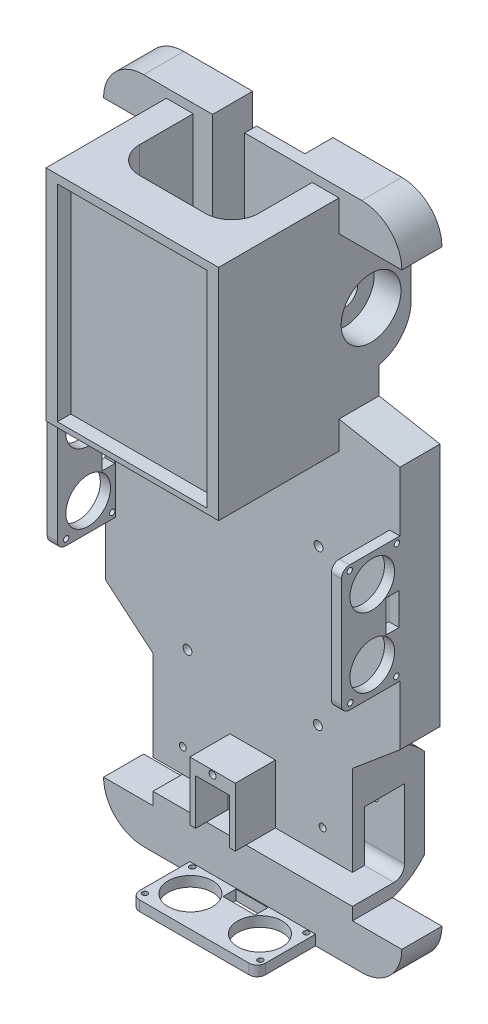
from build123d import *

# Parameters (mm, degrees)
CROQUIS1_W                  = 30
CROQUIS1_H                  = 30
SALIENTE_EXTRUIR1_DEPTH     = 15
CROQUIS6_R                  = 11.175
CORTAR_EXTRUIR1_DEPTH       = 10
CROQUIS11_W                 = 17.25
CROQUIS11_H                 = 40
SALIENTE_EXTRUIR3_DEPTH     = 12
CORTAR_EXTRUIR2_DEPTH       = 220.794464504
CORTAR_EXTRUIR2_DEPTH_BACK  = 220.794464504
CROQUIS9_R                  = 5
CROQUIS14_W                 = 64.5
CROQUIS14_H                 = 82
SALIENTE_EXTRUIR4_DEPTH     = 40
CORTAR_EXTRUIR3_START       = -10
CROQUIS10_R                 = 11.175
CORTAR_EXTRUIR3_DEPTH       = 10
CORTAR_EXTRUIR5_DEPTH       = 230.716361252
CORTAR_EXTRUIR5_DEPTH_BACK  = 10
CROQUIS13_R                 = 11.175
CORTAR_EXTRUIR6_DEPTH       = 183.220714139
CROQUIS16_W                 = 64.5
CROQUIS16_H                 = 82
CROQUIS16_W_2               = 56
CROQUIS16_H_2               = 77
SALIENTE_EXTRUIR5_DEPTH     = 5
CROQUIS17_W                 = 30
CROQUIS17_H                 = 30
CORTAR_EXTRUIR7_DEPTH       = 218.102899858
CROQUIS19_W                 = 18
CROQUIS19_H                 = 4.5
SALIENTE_EXTRUIR6_DEPTH     = 60
CROQUIS22_W                 = 12
CROQUIS22_H                 = 15
CORTAR_EXTRUIR8_DEPTH       = 2
CROQUIS23_W                 = 3.8
CROQUIS23_H                 = 47
SALIENTE_EXTRUIR8_DEPTH     = 19.8
CROQUIS24_R                 = 8.35
CROQUIS24_R_2               = 1
CROQUIS24_W                 = 4.8
CROQUIS24_H                 = 12
CORTAR_EXTRUIR10_DEPTH      = 241.553879883
CROQUIS25_W                 = 3.8
CROQUIS25_H                 = 47
SALIENTE_EXTRUIR9_DEPTH     = 2
REDONDEO2_R                 = 3
CROQUIS26_W                 = 47
CROQUIS26_H                 = 3.8
SALIENTE_EXTRUIR10_DEPTH    = 21.8
REDONDEO3_R                 = 3
CROQUIS28_R                 = 8.35
CROQUIS28_R_2               = 1
CROQUIS28_W                 = 12
CROQUIS28_H                 = 4.8
CORTAR_EXTRUIR11_DEPTH      = 21.8
CORTAR_EXTRUIR12_DEPTH      = 231.964513782
CORTAR_EXTRUIR12_DEPTH_BACK = 231.964513782
CORTAR_EXTRUIR13_DEPTH      = 218.102899858
CORTAR_EXTRUIR13_DEPTH_BACK = 218.102899858
CROQUIS29_R                 = 1.65
CORTAR_EXTRUIR14_DEPTH      = 221.700405815
CORTAR_EXTRUIR14_DEPTH_BACK = 8
CROQUIS32_R                 = 5.15
CROQUIS34_W                 = 22.273731586
CROQUIS34_H                 = 49.346142378
SALIENTE_EXTRUIR11_DEPTH    = 12
CORTAR_EXTRUIR17_DEPTH      = 233.924926242
CORTAR_EXTRUIR17_DEPTH_BACK = 233.924926242
CORTAR_EXTRUIR18_DEPTH      = 233.924926242
CORTAR_EXTRUIR18_DEPTH_BACK = 233.924926242
CORTAR_EXTRUIR19_DEPTH      = 225.26027095
CORTAR_EXTRUIR19_DEPTH_BACK = 225.26027095
CROQUIS38_R                 = 1.3
CORTAR_EXTRUIR20_START      = -8.5
CROQUIS39_W                 = 74.547463172
CROQUIS39_H                 = 11
CORTAR_EXTRUIR20_DEPTH      = 8.5
CROQUIS40_W                 = 17
CROQUIS40_H                 = 22
SALIENTE_EXTRUIR12_DEPTH    = 15
CROQUIS41_R                 = 1.3
CORTAR_EXTRUIR25_DEPTH      = 15
CROQUIS42_W                 = 12.6
CROQUIS42_H                 = 7
CORTAR_EXTRUIR26_DEPTH      = 7.1
CROQUIS43_W                 = 12.6
CROQUIS43_H                 = 10
CORTAR_EXTRUIR27_DEPTH      = 12.1


with BuildPart() as part:
    # Croquis1 → Saliente-Extruir1 (new body)
    with BuildSketch(Plane.XY):
        with BuildLine():
            Line((-55.75, 30), (-32.25, 30))
            Line((-32.25, 30), (-32.25, -30))
            Line((-32.25, -30), (-55, -34.220247666))
            Line((-55, -34.220247666), (-55, -125.720247666))
            Line((-55, -125.720247666), (-37.273731586, -140.594352954))
            Line((-37.273731586, -140.594352954), (-37.273731586, -189.940495332))
            Line((-37.273731586, -189.940495332), (-55.75, -189.940495332))
            ThreePointArc((-55.75, -189.940495332), (-51.356645257, -200.54705351), (-40.750123148, -204.940495332))
            Line((-40.750123148, -204.940495332), (0, -204.940495332))
            Line((0, -204.940495332), (40.75, -204.940495332))
            ThreePointArc((40.75, -204.940495332), (51.356601718, -200.547097049), (55.75, -189.940495332))
            Line((55.75, -189.940495332), (37.273731586, -189.940495332))
            Line((37.273731586, -189.940495332), (37.273731586, -140.594352954))
            Line((37.273731586, -140.594352954), (55, -125.720247666))
            Line((55, -125.720247666), (55, -34.220247666))
            Line((55, -34.220247666), (32.25, -30))
            Line((32.25, -30), (32.25, 30))
            Line((32.25, 30), (55.75, 30))
            ThreePointArc((55.75, 30), (51.356601718, 40.606601718), (40.75, 45))
            Line((40.75, 45), (0, 45))
            Line((0, 45), (-40.750123148, 45))
            ThreePointArc((-40.750123148, 45), (-51.356645257, 40.606558178), (-55.75, 30))
        make_face()
        Rectangle(CROQUIS1_W, CROQUIS1_H, mode=Mode.SUBTRACT)
    extrude(amount=SALIENTE_EXTRUIR1_DEPTH)

    # Croquis6 → Cortar-Extruir1 (cut)
    with BuildSketch(Plane.ZY.offset(32.25)):
        with Locations((3, 0)):
            Circle(CROQUIS6_R)
    extrude(amount=-CORTAR_EXTRUIR1_DEPTH, mode=Mode.SUBTRACT)

    # Croquis11 → Saliente-Extruir3 (add)
    with BuildSketch(Plane(origin=(0, 0, 0), x_dir=(-1, 0, 0), z_dir=(0, 0, -1))):
        with Locations((23.625, 0)):
            Rectangle(CROQUIS11_W, CROQUIS11_H)
        with Locations((-23.625, 0)):
            Rectangle(CROQUIS11_W, CROQUIS11_H)
    extrude(amount=SALIENTE_EXTRUIR3_DEPTH)

    # Croquis9 → Cortar-Extruir2 (cut, two sides: drawn at the far end of the back side and taken through both)
    with BuildSketch(Plane.ZY.offset(22.25).offset(-CORTAR_EXTRUIR2_DEPTH_BACK)):
        with Locations(Location((3, 0, 0), (0, 0, 233.130102354))):
            Circle(CROQUIS9_R)
    extrude(amount=CORTAR_EXTRUIR2_DEPTH + CORTAR_EXTRUIR2_DEPTH_BACK, mode=Mode.SUBTRACT)

    # Croquis14 → Saliente-Extruir4 (add)
    with BuildSketch(Plane.XY.offset(15)):
        with Locations((0, 0.593167368)):
            Rectangle(CROQUIS14_W, CROQUIS14_H)
    extrude(amount=SALIENTE_EXTRUIR4_DEPTH)

    # Croquis10 → Cortar-Extruir3 (cut)
    with BuildSketch(Plane(origin=(32.25, 0, 0), x_dir=(0, 0, -1), z_dir=(1, 0, 0)).offset(CORTAR_EXTRUIR3_START)):
        with Locations((-3, 0)):
            Circle(CROQUIS10_R)
    extrude(amount=CORTAR_EXTRUIR3_DEPTH, mode=Mode.SUBTRACT)

    # Croquis13 → Cortar-Extruir5 (cut, two sides: drawn at the far end of the back side and taken through both)
    with BuildSketch(Plane.ZY.offset(32.25).offset(-CORTAR_EXTRUIR5_DEPTH_BACK)):
        with Locations((3, 0)):
            Circle(CROQUIS13_R)
    extrude(amount=CORTAR_EXTRUIR5_DEPTH + CORTAR_EXTRUIR5_DEPTH_BACK, mode=Mode.SUBTRACT)

    # Croquis15 → Cortar-Extruir6 (cut, through all)
    with BuildSketch(Plane.XZ.offset(40.406832632)):
        with BuildLine():
            Line((-22.25, 15), (-22.25, 35))
            ThreePointArc((-22.25, 35), (-19.321067812, 42.071067812), (-12.25, 45))
            Line((-12.25, 45), (12.25, 45))
            ThreePointArc((12.25, 45), (19.321067812, 42.071067812), (22.25, 35))
            Line((22.25, 35), (22.25, 15))
            Line((22.25, 15), (-22.25, 15))
        make_face()
    extrude(amount=-CORTAR_EXTRUIR6_DEPTH, mode=Mode.SUBTRACT)

    # Croquis16 → Saliente-Extruir5 (add)
    with BuildSketch(Plane.XY.offset(55)):
        with Locations((0, 0.593167368)):
            Rectangle(CROQUIS16_W, CROQUIS16_H)
        Rectangle(CROQUIS16_W_2, CROQUIS16_H_2, mode=Mode.SUBTRACT)
    extrude(amount=SALIENTE_EXTRUIR5_DEPTH)

    # Croquis17 → Cortar-Extruir7 (cut, through all)
    with BuildSketch(Plane.XY.offset(15)):
        with Locations((0, 30)):
            Rectangle(CROQUIS17_W, CROQUIS17_H)
    extrude(amount=-CORTAR_EXTRUIR7_DEPTH, mode=Mode.SUBTRACT)

    # Croquis19 → Saliente-Extruir6 (add)
    with BuildSketch(Plane(origin=(0, -15, 0), x_dir=(1, 0, 0), z_dir=(0, 1, 0))):
        with Locations((6, -12.75)):
            Rectangle(CROQUIS19_W, CROQUIS19_H)
    extrude(amount=SALIENTE_EXTRUIR6_DEPTH)

    # Croquis22 → Cortar-Extruir8 (cut)
    with BuildSketch(Plane(origin=(0, -15, 0), x_dir=(1, 0, 0), z_dir=(0, 1, 0))):
        with Locations((-9, -7.5)):
            Rectangle(CROQUIS22_W, CROQUIS22_H)
    extrude(amount=-CORTAR_EXTRUIR8_DEPTH, mode=Mode.SUBTRACT)

    # Croquis23 → Saliente-Extruir8 (add)
    with BuildSketch(Plane.XY.offset(15)):
        with Locations((53.1, -79.970247666)):
            Rectangle(CROQUIS23_W, CROQUIS23_H)
        with Locations((-53.1, -79.970247666)):
            Rectangle(CROQUIS23_W, CROQUIS23_H)
    extrude(amount=SALIENTE_EXTRUIR8_DEPTH)

    # Croquis24 → Cortar-Extruir10 (cut, through all)
    with BuildSketch(Plane(origin=(55, 0, 0), x_dir=(0, 0, -1), z_dir=(1, 0, 0))):
        with Locations((-25.3, -66.970247666)):
            Circle(CROQUIS24_R)
        with Locations((-25.3, -92.970247666)):
            Circle(CROQUIS24_R)
        with Locations((-16.3, -101.270247666)):
            Circle(CROQUIS24_R_2)
        with Locations((-33.7, -58.370247666)):
            Circle(CROQUIS24_R_2)
        with Locations((-16.1, -58.370247666)):
            Circle(CROQUIS24_R_2)
        with Locations((-33.5, -101.270247666)):
            Circle(CROQUIS24_R_2)
        with Locations((-17.7, -79.970247666)):
            Rectangle(CROQUIS24_W, CROQUIS24_H)
    extrude(amount=-CORTAR_EXTRUIR10_DEPTH, mode=Mode.SUBTRACT)

    # Croquis25 → Saliente-Extruir9 (add)
    with BuildSketch(Plane.XY.offset(34.8)):
        with Locations((-53.1, -79.970247666)):
            Rectangle(CROQUIS25_W, CROQUIS25_H)
        with Locations((53.1, -79.970247666)):
            Rectangle(CROQUIS25_W, CROQUIS25_H)
    extrude(amount=SALIENTE_EXTRUIR9_DEPTH)

    # Redondeo2
    redondeo2_edges = [part.edges().sort_by_distance(p)[0] for p in [
        (-53.1, -103.470247666, 36.8),
        (-53.1, -56.470247666, 36.8),
        (53.1, -103.470247666, 36.8),
        (53.1, -56.470247666, 36.8),
    ]]
    fillet(redondeo2_edges, radius=REDONDEO2_R)

    # Croquis26 → Saliente-Extruir10 (add)
    with BuildSketch(Plane.XY.offset(15)):
        with Locations((-6.1574e-05, -203.040495332)):
            Rectangle(CROQUIS26_W, CROQUIS26_H)
    extrude(amount=SALIENTE_EXTRUIR10_DEPTH)

    # Redondeo3
    redondeo3_edges = [part.edges().sort_by_distance(p)[0] for p in [
        (-23.500061574, -203.040495332, 36.8),
        (23.499938426, -203.040495332, 36.8),
    ]]
    fillet(redondeo3_edges, radius=REDONDEO3_R)

    # Croquis28 → Cortar-Extruir11 (cut)
    with BuildSketch(Plane.XZ.offset(204.940495332)):
        with Locations(Location((-13, 25.3, 0), (0, 0, 270))):
            Circle(CROQUIS28_R)
        with Locations(Location((13, 25.3, 0), (0, 0, 270))):
            Circle(CROQUIS28_R)
        with Locations(Location((-21.300061574, 16.3, 0), (0, 0, 270))):
            Circle(CROQUIS28_R_2)
        with Locations(Location((21.599938426, 33.7, 0), (0, 0, 270))):
            Circle(CROQUIS28_R_2)
        with Locations(Location((21.300061574, 16.3, 0), (0, 0, 270))):
            Circle(CROQUIS28_R_2)
        with Locations(Location((-21.599938426, 33.7, 0), (0, 0, 270))):
            Circle(CROQUIS28_R_2)
        with Locations((0, 17.7)):
            Rectangle(CROQUIS28_W, CROQUIS28_H)
    extrude(amount=-CORTAR_EXTRUIR11_DEPTH, mode=Mode.SUBTRACT)

    # Croquis12 → Cortar-Extruir12 (cut, two sides: drawn at the far end of the back side and taken through both)
    with BuildSketch(Plane(origin=(32.25, 0, 0), x_dir=(0, 0, -1), z_dir=(1, 0, 0)).offset(-CORTAR_EXTRUIR12_DEPTH_BACK)):
        with BuildLine():
            Line((0, 20), (12, 20))
            Line((12, 20), (12, 5))
            ThreePointArc((12, 5), (8.630857945, 14.604686356), (0, 20))
        make_face()
        with BuildLine():
            Line((12, -20), (12, -5))
            ThreePointArc((12, -5), (8.630857945, -14.604686356), (0, -20))
            Line((0, -20), (12, -20))
        make_face()
    extrude(amount=CORTAR_EXTRUIR12_DEPTH + CORTAR_EXTRUIR12_DEPTH_BACK, mode=Mode.SUBTRACT)

    # Croquis29 → Cortar-Extruir13 (cut, two sides: drawn at the far end of the back side and taken through both)
    with BuildSketch(Plane.XY.offset(15).offset(-CORTAR_EXTRUIR13_DEPTH_BACK)):
        with Locations(Location((-24.373731586, -132.994352954, 0), (0, 0, 180))):
            Circle(CROQUIS29_R)
        with Locations(Location((24.626268414, -74.994352954, 0), (0, 0, 180))):
            Circle(CROQUIS29_R)
        with Locations(Location((-24.626268414, -74.994352954, 0), (0, 0, 180))):
            Circle(CROQUIS29_R)
        with Locations(Location((24.373731586, -132.994352954, 0), (0, 0, 180))):
            Circle(CROQUIS29_R)
    extrude(amount=CORTAR_EXTRUIR13_DEPTH + CORTAR_EXTRUIR13_DEPTH_BACK, mode=Mode.SUBTRACT)

    # Croquis32 → Cortar-Extruir14 (cut, two sides: drawn at the far end of the back side and taken through both)
    with BuildSketch(Plane(origin=(0, 0, 0), x_dir=(-1, 0, 0), z_dir=(0, 0, -1)).offset(-CORTAR_EXTRUIR14_DEPTH_BACK)):
        with Locations(Location((-24.626268414, -74.994352954, 0), (0, 0, 180))):
            Circle(CROQUIS32_R)
        with Locations(Location((-24.373731586, -132.994352954, 0), (0, 0, 180))):
            Circle(CROQUIS32_R)
        with Locations(Location((24.373731586, -132.994352954, 0), (0, 0, 180))):
            Circle(CROQUIS32_R)
        with Locations(Location((24.626268414, -74.994352954, 0), (0, 0, 180))):
            Circle(CROQUIS32_R)
    extrude(amount=CORTAR_EXTRUIR14_DEPTH + CORTAR_EXTRUIR14_DEPTH_BACK, mode=Mode.SUBTRACT)

    # Croquis34 → Saliente-Extruir11 (add)
    with BuildSketch(Plane(origin=(0, 0, 0), x_dir=(-1, 0, 0), z_dir=(0, 0, -1))):
        with Locations((-26.136865793, -165.267424143)):
            Rectangle(CROQUIS34_W, CROQUIS34_H)
        with Locations((26.136865793, -165.267424143)):
            Rectangle(CROQUIS34_W, CROQUIS34_H)
    extrude(amount=SALIENTE_EXTRUIR11_DEPTH)

    # Croquis35 → Cortar-Extruir17 (cut, two sides: drawn at the far end of the back side and taken through both)
    with BuildSketch(Plane(origin=(37.273731586, 0, 0), x_dir=(0, 0, -1), z_dir=(1, 0, 0)).offset(-CORTAR_EXTRUIR17_DEPTH_BACK)):
        with BuildLine():
            Line((0, -140.594352954), (12, -140.594352954))
            Line((12, -140.594352954), (12, -148.594352954))
            ThreePointArc((12, -148.594352954), (6.568730644, -143.741256988), (0, -140.594352954))
        make_face()
        with BuildLine():
            Line((0, -189.940495332), (12, -189.940495332))
            Line((12, -189.940495332), (12, -181.940495332))
            ThreePointArc((12, -181.940495332), (6.568730644, -186.793591298), (0, -189.940495332))
        make_face()
    extrude(amount=CORTAR_EXTRUIR17_DEPTH + CORTAR_EXTRUIR17_DEPTH_BACK, mode=Mode.SUBTRACT)

    # Croquis37 → Cortar-Extruir18 (cut, two sides: drawn at the far end of the back side and taken through both)
    with BuildSketch(Plane.ZY.offset(37.273731586).offset(-CORTAR_EXTRUIR18_DEPTH_BACK)):
        with BuildLine():
            Line((-4.5, -155.267424143), (10.5, -155.267424143))
            Line((10.5, -155.267424143), (10.5, -181.267424143))
            ThreePointArc((10.5, -181.267424143), (9.328427125, -184.095851268), (6.5, -185.267424143))
            Line((6.5, -185.267424143), (-0.5, -185.267424143))
            ThreePointArc((-0.5, -185.267424143), (-3.328427125, -184.095851268), (-4.5, -181.267424143))
            Line((-4.5, -181.267424143), (-4.5, -155.267424143))
        make_face()
    extrude(amount=CORTAR_EXTRUIR18_DEPTH + CORTAR_EXTRUIR18_DEPTH_BACK, mode=Mode.SUBTRACT)

    # Croquis38 → Cortar-Extruir19 (cut, two sides: drawn at the far end of the back side and taken through both)
    with BuildSketch(Plane(origin=(0, 0, -12), x_dir=(-1, 0, 0), z_dir=(0, 0, -1)).offset(-CORTAR_EXTRUIR19_DEPTH_BACK)):
        with Locations((-26.136865793, -165.267424143)):
            Circle(CROQUIS38_R)
        with Locations((26.136865793, -165.267424143)):
            Circle(CROQUIS38_R)
    extrude(amount=CORTAR_EXTRUIR19_DEPTH + CORTAR_EXTRUIR19_DEPTH_BACK, mode=Mode.SUBTRACT)

    # Croquis39 → Cortar-Extruir20 (cut)
    with BuildSketch(Plane.XY.offset(15).offset(CORTAR_EXTRUIR20_START)):
        with Locations((0, -179.767424143)):
            Rectangle(CROQUIS39_W, CROQUIS39_H)
    extrude(amount=CORTAR_EXTRUIR20_DEPTH, mode=Mode.SUBTRACT)

    # Croquis40 → Saliente-Extruir12 (add)
    with BuildSketch(Plane.XY.offset(15)):
        with Locations((0, -163.267424143)):
            Rectangle(CROQUIS40_W, CROQUIS40_H)
    extrude(amount=SALIENTE_EXTRUIR12_DEPTH)

    # Croquis41 → Cortar-Extruir25 (cut)
    with BuildSketch(Plane.XY.offset(30)):
        with Locations((0, -153.767424143)):
            Circle(CROQUIS41_R)
    extrude(amount=-CORTAR_EXTRUIR25_DEPTH, mode=Mode.SUBTRACT)

    # Croquis42 → Cortar-Extruir26 (cut)
    with BuildSketch(Plane.XY.offset(30)):
        with Locations((0, -160.767424143)):
            Rectangle(CROQUIS42_W, CROQUIS42_H)
    extrude(amount=-CORTAR_EXTRUIR26_DEPTH, mode=Mode.SUBTRACT)

    # Croquis43 → Cortar-Extruir27 (cut)
    with BuildSketch(Plane.XY.offset(30)):
        with Locations((0, -169.267424143)):
            Rectangle(CROQUIS43_W, CROQUIS43_H)
    extrude(amount=-CORTAR_EXTRUIR27_DEPTH, mode=Mode.SUBTRACT)


solid = part.part
